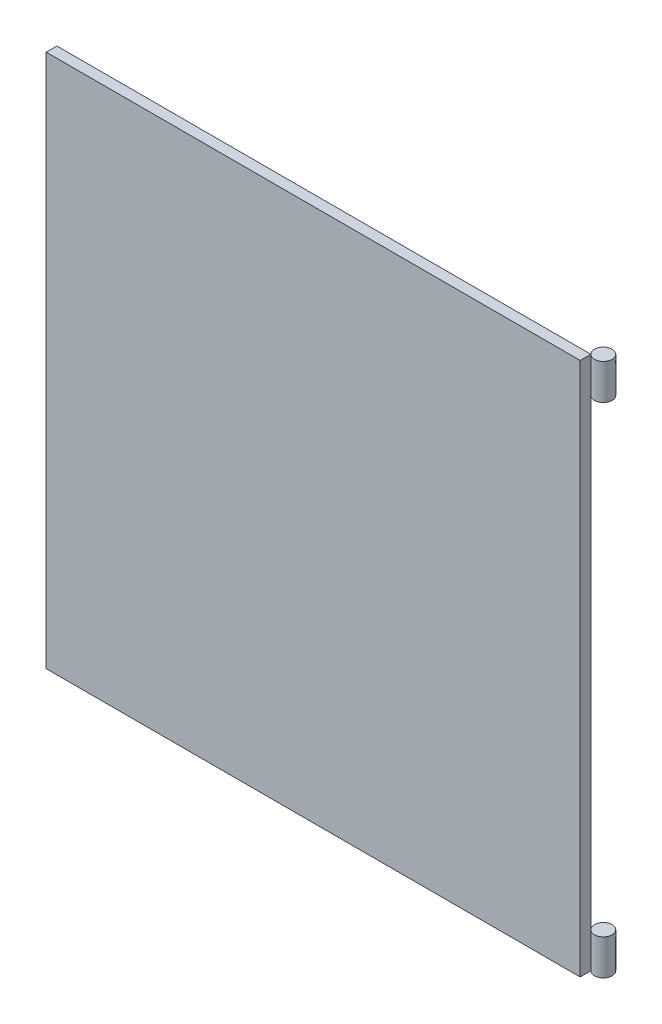
from build123d import *

# Parameters (mm, degrees)
CROQUIS1_W              = 300
CROQUIS1_H              = 300
SALIENTE_EXTRUIR1_DEPTH = 6
CROQUIS2_R              = 4.949747468
SALIENTE_EXTRUIR2_DEPTH = 20
CROQUIS3_R              = 4.949747468
SALIENTE_EXTRUIR3_DEPTH = 20


with BuildPart() as part:
    # Croquis1 → Saliente-Extruir1 (new body)
    with BuildSketch(Plane.XY):
        with Locations((150, -150)):
            Rectangle(CROQUIS1_W, CROQUIS1_H)
    extrude(amount=SALIENTE_EXTRUIR1_DEPTH)


with BuildPart() as body_2:
    # Croquis2 → Saliente-Extruir2 (new body)
    with BuildSketch(Plane(origin=(0, 0, 0), x_dir=(1, 0, 0), z_dir=(0, 1, 0))):
        with Locations(Location((303.5, 3.5, 0), (0, 0, 270))):
            Circle(CROQUIS2_R)
    extrude(amount=-SALIENTE_EXTRUIR2_DEPTH)


with BuildPart() as body_3:
    # Croquis3 → Saliente-Extruir3 (new body)
    with BuildSketch(Plane.XZ.offset(300)):
        with Locations(Location((303.5, -3.5, 0), (0, 0, 270))):
            Circle(CROQUIS3_R)
    extrude(amount=-SALIENTE_EXTRUIR3_DEPTH)


solid = Compound([part.part, body_2.part, body_3.part])
